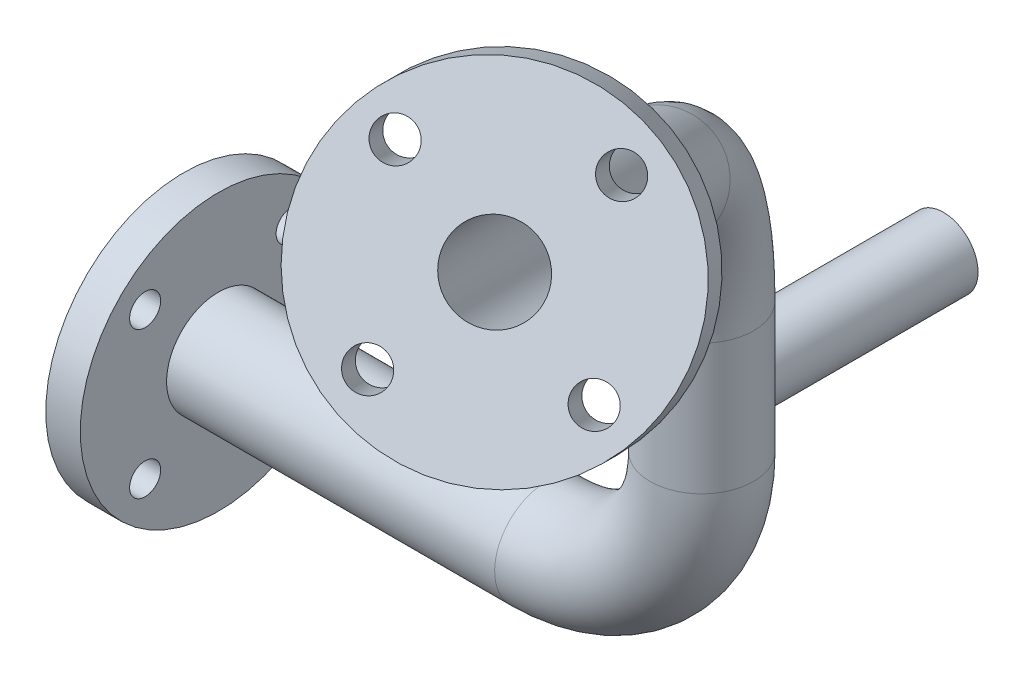
from build123d import *

# Parameters (mm, degrees)
SWEEP_2_PROFILE_R   = 15
SKETCH_2_R          = 40
EXTRUDE_1_DEPTH     = 10
SWEEP_4_PROFILE_R   = 45
SWEEP_6_PROFILE_R   = 10
SWEEP_2_2_PROFILE_R = 12
SKETCH_7_R          = 4.5
CUT_EXTRUDE_1_DEPTH = 10
SWEEP_14_PROFILE_R  = 5.5
SWEEP_16_PROFILE_R  = 5.5
SWEEP_18_PROFILE_R  = 5.5
SWEEP_20_PROFILE_R  = 5.5
SWEEP_24_PROFILE_R  = 7


with BuildPart() as part:
    # Sweep 2: sweep along a curve in space
    with BuildLine() as sweep_2_path:
        Line((0, 0, 0), (105, 0, 0))
        ThreePointArc((105, 0, 0), (136.819805153, 13.180194847, 0), (150, 45, 0))
        Line((150, 45, 0), (150, 82.789579623, 0))
        ThreePointArc((150, 82.789579623, 0), (154.47011502, 114.412356225, 7.822701285), (166.537964612, 136.537964612, 28.941438071))
        Line((166.537964612, 136.537964612, 28.941438071), (230, 200, 140))
    # Sweep 2 profile (on start of the path) → Sweep 2 (sweep)
    with BuildSketch(Plane(origin=(0, 0, 0), x_dir=(0, 0, 1), z_dir=(1, 0, 0))):
        Circle(SWEEP_2_PROFILE_R)
    sweep(path=sweep_2_path.line)

    # 草图2 → 凸台-拉伸1 (add)
    with BuildSketch(Plane(origin=(0, 0, 0), x_dir=(0, 0, -1), z_dir=(1, 0, 0))):
        Circle(SKETCH_2_R)
    extrude(amount=EXTRUDE_1_DEPTH)

    # 扫描4: sweep along a curve in space
    with BuildLine() as sweep_4_path:
        Line((230, 200, 140), (224.666667, 194.666667, 130.666667))
    # 扫描4 profile (on start of the path) → 扫描4 (sweep)
    with BuildSketch(Plane(origin=(230, 200, 140), x_dir=(-0.8682431478491394, 0, 0.4961389283386436), z_dir=(-0.4444444372427982, -0.4444444372427982, -0.7777777860082306))):
        Circle(SWEEP_4_PROFILE_R)
    sweep(path=sweep_4_path.line)

    # 扫描6: sweep along a curve in space
    with BuildLine() as sweep_6_path:
        Line((150, 60, -5), (150, 60, -70))
    # 扫描6 profile (on start of the path) → 扫描6 (sweep)
    with BuildSketch(Plane(origin=(150, 60, -5), x_dir=(-1, 0, 0), z_dir=(0, 0, -1))):
        Circle(SWEEP_6_PROFILE_R)
    sweep(path=sweep_6_path.line)

    # Sweep 2 2: sweep along a curve in space
    with BuildLine() as sweep_2_2_path:
        Line((-5, 0, 0), (105, 0, 0))
        ThreePointArc((105, 0, 0), (136.819805153, 13.180194847, 0), (150, 45, 0))
        Line((150, 45, 0), (150, 82.789575291, 0))
        ThreePointArc((150, 82.789575291, 0), (154.470114667, 114.412354552, 7.822703386), (166.537963061, 136.537963061, 28.941445413))
        Line((166.537963061, 136.537963061, 28.941445413), (232.2222, 202.2222, 143.8889))
    # Sweep 2 2 profile (on start of the path) → Sweep 2 2 (sweep, cut)
    with BuildSketch(Plane(origin=(-5, 0, 0), x_dir=(0, 0, 1), z_dir=(1, 0, 0))):
        Circle(SWEEP_2_2_PROFILE_R)
    sweep(path=sweep_2_2_path.line, mode=Mode.SUBTRACT)

    # 草图7 → 切除-拉伸1 (cut)
    with BuildSketch(Plane(origin=(0, 0, 0), x_dir=(0, 0, -1), z_dir=(1, 0, 0))):
        with Locations((-21.2132, 21.2132)):
            Circle(SKETCH_7_R)
        with Locations((21.2132, 21.2132)):
            Circle(SKETCH_7_R)
        with Locations((21.2132, -21.2132)):
            Circle(SKETCH_7_R)
        with Locations((-21.2132, -21.2132)):
            Circle(SKETCH_7_R)
    extrude(amount=CUT_EXTRUDE_1_DEPTH, mode=Mode.SUBTRACT)

    # 切除-扫描14: sweep along a curve in space
    with BuildLine() as sweep_14_path:
        Line((196.713944, 214.424944, 130.205492), (205.602764, 223.313764, 145.761127))
    # 切除-扫描14 profile (on start of the path) → 切除-扫描14 (sweep, cut)
    with BuildSketch(Plane(origin=(196.713944, 214.424944, 130.205492), x_dir=(0.8682458899522337, 0, -0.4961341296273152), z_dir=(0.4444409876456375, 0.4444409876456375, 0.777781728379589))):
        Circle(SWEEP_14_PROFILE_R)
    sweep(path=sweep_14_path.line, mode=Mode.SUBTRACT)

    # 切除-扫描16: sweep along a curve in space
    with BuildLine() as sweep_16_path:
        Line((238.461944, 214.424944, 106.350492), (247.350764, 223.313764, 121.906127))
    # 切除-扫描16 profile (on start of the path) → 切除-扫描16 (sweep, cut)
    with BuildSketch(Plane(origin=(238.461944, 214.424944, 106.350492), x_dir=(0.8682458899522337, 0, -0.4961341296273152), z_dir=(0.4444409876456375, 0.4444409876456375, 0.777781728379589))):
        Circle(SWEEP_16_PROFILE_R)
    sweep(path=sweep_16_path.line, mode=Mode.SUBTRACT)

    # 切除-扫描18: sweep along a curve in space
    with BuildLine() as sweep_18_path:
        Line((207.315944, 171.352944, 148.760492), (216.204764, 180.241764, 164.316127))
    # 切除-扫描18 profile (on start of the path) → 切除-扫描18 (sweep, cut)
    with BuildSketch(Plane(origin=(207.315944, 171.352944, 148.760492), x_dir=(0.8682458899522337, 0, -0.4961341296273152), z_dir=(0.4444409876456375, 0.4444409876456375, 0.777781728379589))):
        Circle(SWEEP_18_PROFILE_R)
    sweep(path=sweep_18_path.line, mode=Mode.SUBTRACT)

    # 切除-扫描20: sweep along a curve in space
    with BuildLine() as sweep_20_path:
        Line((249.063944, 171.352944, 124.905492), (257.952764, 180.241764, 140.461127))
    # 切除-扫描20 profile (on start of the path) → 切除-扫描20 (sweep, cut)
    with BuildSketch(Plane(origin=(249.063944, 171.352944, 124.905492), x_dir=(0.8682458899522337, 0, -0.4961341296273152), z_dir=(0.4444409876456375, 0.4444409876456375, 0.777781728379589))):
        Circle(SWEEP_20_PROFILE_R)
    sweep(path=sweep_20_path.line, mode=Mode.SUBTRACT)

    # 切除-扫描24: sweep along a curve in space
    with BuildLine() as sweep_24_path:
        Line((150, 60, 10), (150, 60, -70))
    # 切除-扫描24 profile (on start of the path) → 切除-扫描24 (sweep, cut)
    with BuildSketch(Plane(origin=(150, 60, 10), x_dir=(-1, 0, 0), z_dir=(0, 0, -1))):
        Circle(SWEEP_24_PROFILE_R)
    sweep(path=sweep_24_path.line, mode=Mode.SUBTRACT)


solid = part.part
